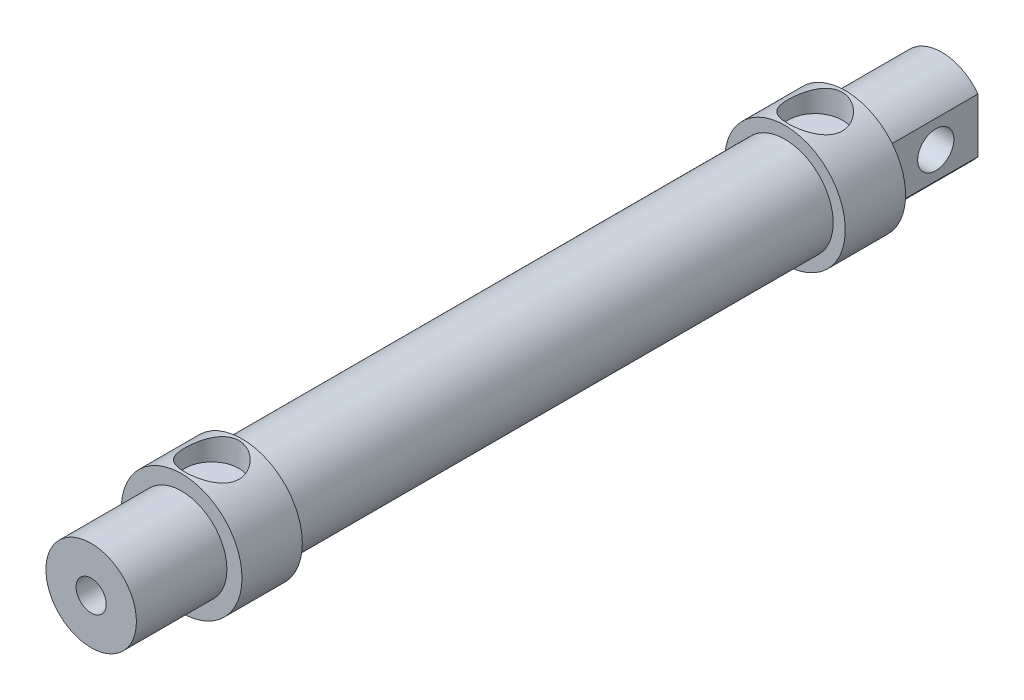
from build123d import *

# Parameters (mm, degrees)
SKETCH1_R           = 8
BOSS_EXTRUDE1_DEPTH = 90
SKETCH2_R           = 10
BOSS_EXTRUDE2_DEPTH = 10
BOSS_EXTRUDE3_START = 10
SKETCH3_R           = 10
BOSS_EXTRUDE3_DEPTH = 10
SKETCH4_R           = 7.5
BOSS_EXTRUDE4_DEPTH = 15
BOSS_EXTRUDE5_START = 16
SKETCH5_R           = 7.5
BOSS_EXTRUDE5_DEPTH = 16
SKETCH6_R           = 2.5
CUT_EXTRUDE1_DEPTH  = 16
SKETCH7_R           = 4.5
CUT_EXTRUDE2_DEPTH  = 4
CUT_EXTRUDE3_DEPTH  = 16
SKETCH9_R           = 3
CUT_EXTRUDE4_DEPTH  = 117.53754762


with BuildPart() as part:
    # Sketch1 → Boss-Extrude1 (new body)
    with BuildSketch(Plane.XY):
        with Locations(Location((0, 0, 0), (0, 0, 180))):
            Circle(SKETCH1_R)
    extrude(amount=BOSS_EXTRUDE1_DEPTH)

    # Sketch2 → Boss-Extrude2 (add)
    with BuildSketch(Plane(origin=(0, 0, 0), x_dir=(-1, 0, 0), z_dir=(0, 0, -1))):
        Circle(SKETCH2_R)
    extrude(amount=BOSS_EXTRUDE2_DEPTH)

    # Sketch3 → Boss-Extrude3 (add)
    with BuildSketch(Plane.XY.offset(90).offset(BOSS_EXTRUDE3_START)):
        with Locations(Location((0, 0, 0), (0, 0, 180))):
            Circle(SKETCH3_R)
    extrude(amount=-BOSS_EXTRUDE3_DEPTH)

    # Sketch4 → Boss-Extrude4 (add)
    with BuildSketch(Plane.XY.offset(100)):
        Circle(SKETCH4_R)
    extrude(amount=BOSS_EXTRUDE4_DEPTH)

    # Sketch5 → Boss-Extrude5 (add)
    with BuildSketch(Plane(origin=(0, 0, -10), x_dir=(-1, 0, 0), z_dir=(0, 0, -1)).offset(BOSS_EXTRUDE5_START)):
        with Locations(Location((0, 0, 0), (0, 0, 180))):
            Circle(SKETCH5_R)
    extrude(amount=-BOSS_EXTRUDE5_DEPTH)

    # Sketch6 → Cut-Extrude1 (cut)
    with BuildSketch(Plane.XY.offset(115)):
        Circle(SKETCH6_R)
    extrude(amount=-CUT_EXTRUDE1_DEPTH, mode=Mode.SUBTRACT)

    # Sketch7 → Cut-Extrude2 (cut)
    with BuildSketch(Plane(origin=(0, 10, 0), x_dir=(-1, 0, 0), z_dir=(0, 1, 0))):
        with Locations(Location((0, 95, 0), (0, 0, 90))):
            Circle(SKETCH7_R)
        with Locations(Location((0, -5, 0), (0, 0, 90))):
            Circle(SKETCH7_R)
    extrude(amount=-CUT_EXTRUDE2_DEPTH, mode=Mode.SUBTRACT)

    # Sketch8 → Cut-Extrude3 (cut)
    with BuildSketch(Plane(origin=(0, 0, -26), x_dir=(-1, 0, 0), z_dir=(0, 0, -1))):
        with BuildLine():
            Line((-6, 4.5), (-6, -4.5))
            ThreePointArc((-6, -4.5), (-7.5, 0), (-6, 4.5))
        make_face()
        with BuildLine():
            Line((6, 4.5), (6, -4.5))
            ThreePointArc((6, -4.5), (7.5, 0), (6, 4.5))
        make_face()
    extrude(amount=-CUT_EXTRUDE3_DEPTH, mode=Mode.SUBTRACT)

    # Sketch9 → Cut-Extrude4 (cut, through all)
    with BuildSketch(Plane(origin=(6, 0, 0), x_dir=(0, 0, -1), z_dir=(1, 0, 0))):
        with Locations((19, 0)):
            Circle(SKETCH9_R)
    extrude(amount=-CUT_EXTRUDE4_DEPTH, mode=Mode.SUBTRACT)


solid = part.part
